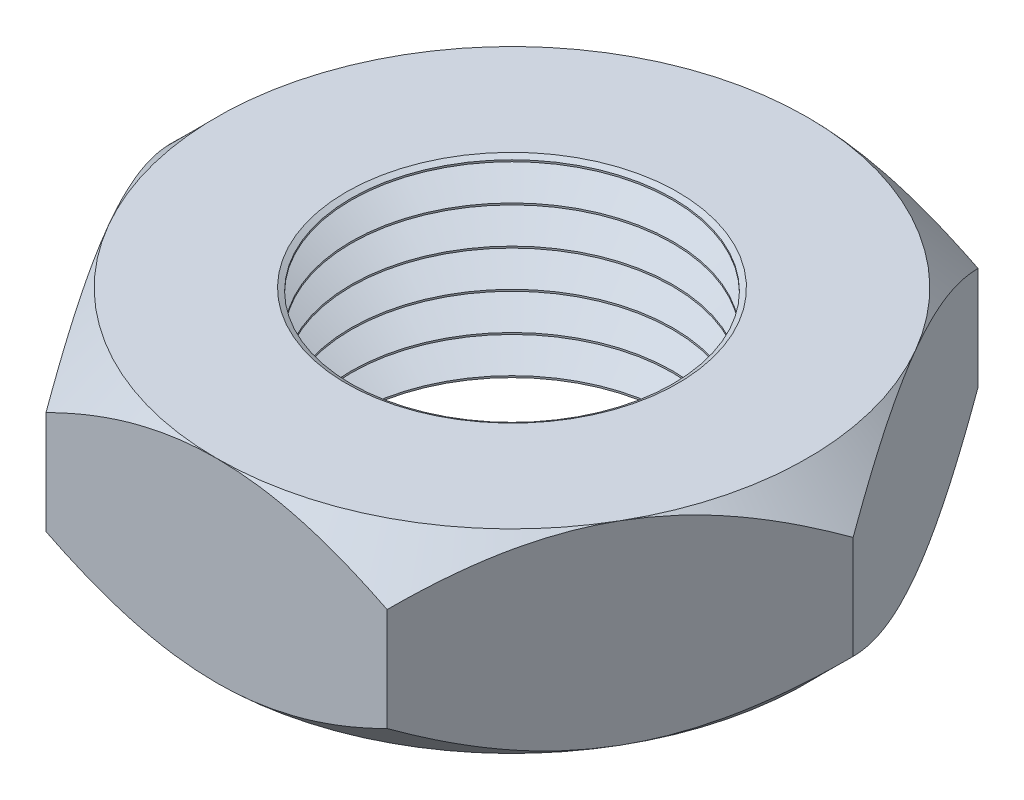
from build123d import *

# Parameters (mm, degrees)
BOSS_EXTRUDE2_DEPTH = 2.6
SKETCH15_OUTSIDE_W  = 18.79
SKETCH15_OUTSIDE_H  = 17.568
SKETCH15_OUTSIDE_R  = 3.95
CUT_EXTRUDE4_DEPTH  = 2.6
CUT_EXTRUDE4_DRAFT  = -45
SKETCH16_OUTSIDE_W  = 18.79
SKETCH16_OUTSIDE_H  = 17.568
SKETCH16_OUTSIDE_R  = 3.95
CUT_EXTRUDE5_DEPTH  = 2.6
CUT_EXTRUDE5_DRAFT  = -45


with BuildPart() as part:
    # Sketch2 → Boss-Extrude2 (new body)
    with BuildSketch(Plane(origin=(0, 0, 0), x_dir=(1, 0, 0), z_dir=(0, 1, 0))):
        Polygon((-4.561067127, 0), (-2.280533563, -3.95), (2.280533563, -3.95), (4.561067127, 0), (2.280533563, 3.95), (-2.280533563, 3.95), align=None)
    extrude(amount=BOSS_EXTRUDE2_DEPTH)

    # Sketch13 → Cut-Revolve1 (revolve, cut)
    with BuildSketch(Plane.XY):
        Polygon((0, 2.6), (2.217, 2.6), (2.150316044, 2.5615), (2.150316044, 2.5385), (2.563410162, 2.3), (2.150316044, 2.0615), (2.150316044, 2.0385), (2.563410162, 1.8), (2.150316044, 1.5615), (2.150316044, 1.5385), (2.563410162, 1.3), (2.150316044, 1.0615), (2.150316044, 1.0385), (2.563410162, 0.8), (2.150316044, 0.5615), (2.150316044, 0.5385), (2.563410162, 0.3), (2.150316044, 0.0615), (2.150316044, 0.0385), (2.217, 0), (0, 0), align=None)
    revolve(axis=Axis((0, 4.352000656, 0), (0, -1, 0)), mode=Mode.SUBTRACT)


with BuildPart() as cut_extrude4_tool:
    # Sketch15 outside → Cut-Extrude4 (with draft: the straight prism first)
    with BuildSketch(Plane(origin=(0, 2.6, 0), x_dir=(1, 0, 0), z_dir=(0, 1, 0))):
        Rectangle(SKETCH15_OUTSIDE_W, SKETCH15_OUTSIDE_H)
        Circle(SKETCH15_OUTSIDE_R, mode=Mode.SUBTRACT)
    extrude(amount=-CUT_EXTRUDE4_DEPTH)
    # Cut-Extrude4: the draft: its side faces are tilted about the plane it starts from
    cut_extrude4_sides = [cut_extrude4_tool.faces().sort_by_distance(p)[0] for p in [
        (0, 1.3, 8.784),
        (9.395, 1.3, 0),
        (0, 1.3, -8.784),
        (-9.395, 1.3, 0),
        (-3.95, 1.3, 0),
    ]]
    draft(cut_extrude4_sides, Plane(origin=(0, 2.6, 0), x_dir=(1, 0, 0), z_dir=(0, 1, 0)), CUT_EXTRUDE4_DRAFT)


with BuildPart() as part_1:
    add(part.part)

    # Cut-Extrude4: cut by cut_extrude4_tool
    add(cut_extrude4_tool.part, mode=Mode.SUBTRACT)


with BuildPart() as cut_extrude5_tool:
    # Sketch16 outside → Cut-Extrude5 (with draft: the straight prism first)
    with BuildSketch(Plane.XZ):
        Rectangle(SKETCH16_OUTSIDE_W, SKETCH16_OUTSIDE_H)
        Circle(SKETCH16_OUTSIDE_R, mode=Mode.SUBTRACT)
    extrude(amount=-CUT_EXTRUDE5_DEPTH)
    # Cut-Extrude5: the draft: its side faces are tilted about the plane it starts from
    cut_extrude5_sides = [cut_extrude5_tool.faces().sort_by_distance(p)[0] for p in [
        (0, 1.3, -8.784),
        (9.395, 1.3, 0),
        (0, 1.3, 8.784),
        (-9.395, 1.3, 0),
        (-3.95, 1.3, 0),
    ]]
    draft(cut_extrude5_sides, Plane.XZ, CUT_EXTRUDE5_DRAFT)


with BuildPart() as part_2:
    add(part_1.part)

    # Cut-Extrude5: cut by cut_extrude5_tool
    add(cut_extrude5_tool.part, mode=Mode.SUBTRACT)


solid = part_2.part
